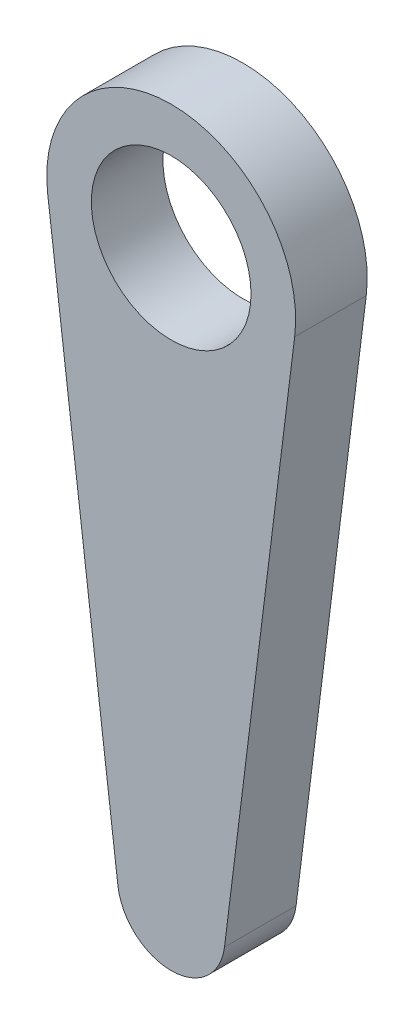
from build123d import *

# Parameters (mm, degrees)
SKETCH_1_R      = 2.23
EXTRUDE_1_DEPTH = 2


with BuildPart() as part:
    # 草图1 → 凸台-拉伸1 (new body)
    with BuildSketch(Plane.XY):
        with BuildLine():
            Line((-3.448374319, -0.429347826), (-1.4885069, -16.170329997))
            ThreePointArc((-1.4885069, -16.170329997), (0, -17.485), (1.4885069, -16.170329997))
            Line((1.4885069, -16.170329997), (3.448374319, -0.429347826))
            ThreePointArc((3.448374319, -0.429347826), (0, 3.475), (-3.448374319, -0.429347826))
        make_face()
        Circle(SKETCH_1_R, mode=Mode.SUBTRACT)
    extrude(amount=EXTRUDE_1_DEPTH)


solid = part.part
